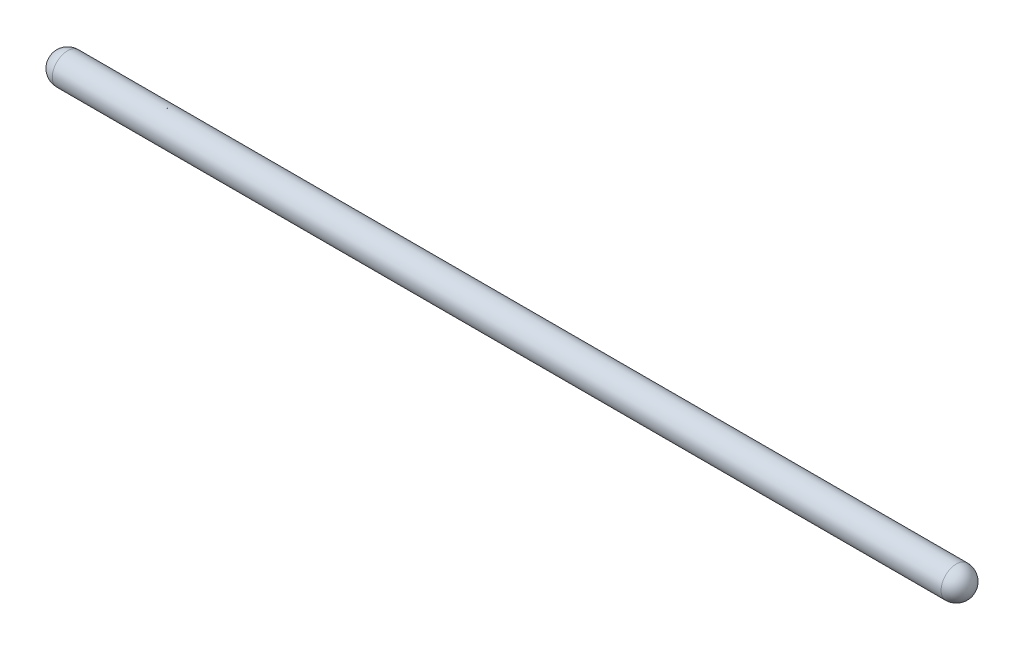
from build123d import *

# Parameters (mm, degrees)
REVOLVE1_ANGLE = 359.999695921


with BuildPart() as part:
    # Sketch1 → Revolve1 (revolve)
    with BuildSketch(Plane.XY):
        with BuildLine():
            Line((2.5, 2.5), (147.5, 2.5))
            ThreePointArc((147.5, 2.5), (149.267766953, 1.767766953), (150, 0))
            Line((150, 0), (0, 0))
            ThreePointArc((0, 0), (0.732233047, 1.767766953), (2.5, 2.5))
        make_face()
    revolve(axis=Axis((0, 0, 0), (1, 0, 0)), revolution_arc=REVOLVE1_ANGLE)


solid = part.part
